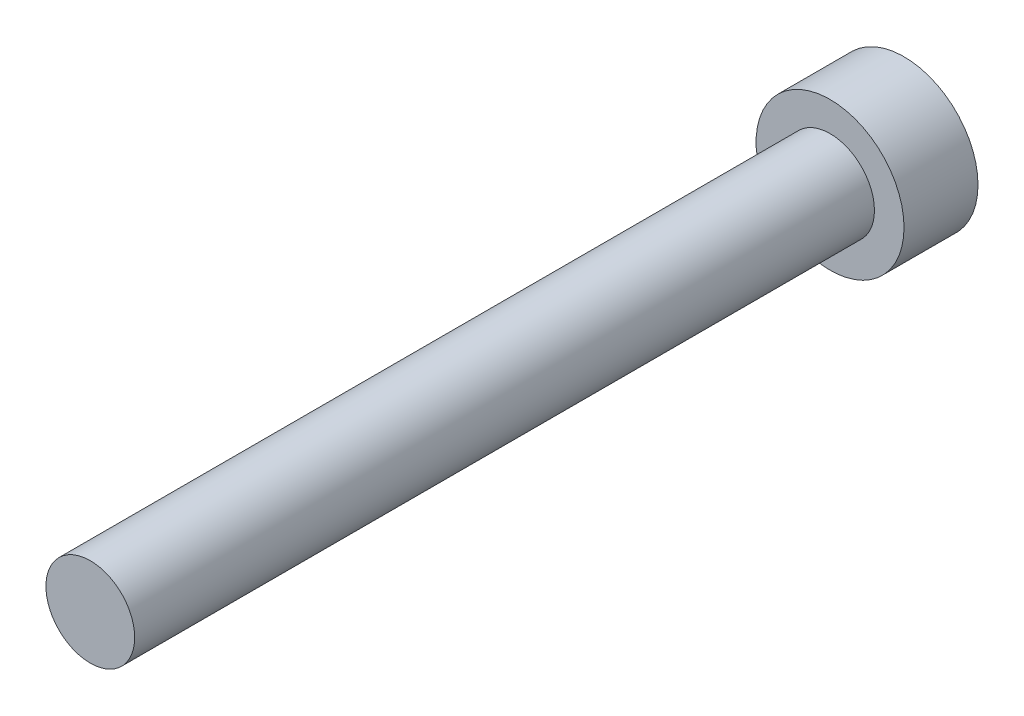
from build123d import *

# Parameters (mm, degrees)
SKETCH1_R           = 2.5
SKETCH1_R_2         = 1.5
BOSS_EXTRUDE3_DEPTH = 2.5
SKETCH1_3_R         = 1.5
BOSS_EXTRUDE4_DEPTH = 25


with BuildPart() as part:
    # Sketch1 → Boss-Extrude3 (new body)
    # profile 1 of 2: a face of its own
    with BuildSketch(Plane.XY):
        Circle(SKETCH1_R)
        Circle(SKETCH1_R_2, mode=Mode.SUBTRACT)
    # profile 2 of 2: a face of its own
    with BuildSketch(Plane.XY):
        Circle(SKETCH1_R_2)
    extrude(amount=-BOSS_EXTRUDE3_DEPTH)

    # Sketch1<3> → Boss-Extrude4 (add)
    with BuildSketch(Plane.XY):
        Circle(SKETCH1_3_R)
    extrude(amount=BOSS_EXTRUDE4_DEPTH)


solid = part.part
